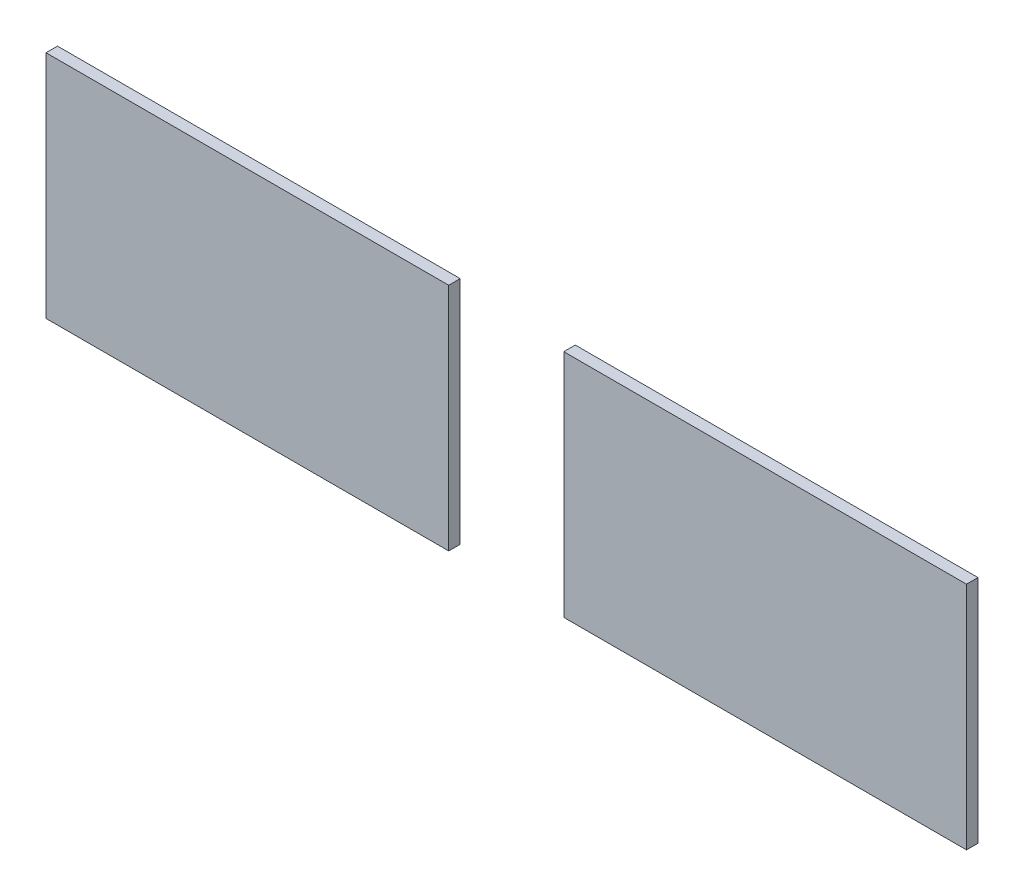
from build123d import *

# Parameters (mm, degrees)
SKETCH_1_W        = 0.7
SKETCH_1_H        = 0.4
EXTRUDE_1_DEPTH   = 0.02
EXTRUDE_1_2_DEPTH = 0.02


with BuildPart() as part:
    # 草图1 → 凸台-拉伸1 (new body)
    with BuildSketch(Plane.XY):
        with Locations((-0.45, 0)):
            Rectangle(SKETCH_1_W, SKETCH_1_H)
    extrude(amount=EXTRUDE_1_DEPTH)


with BuildPart() as body_2:
    # 草图1 → Extrude 1 2 (new body)
    with BuildSketch(Plane.XY):
        with Locations((0.45, 0)):
            Rectangle(SKETCH_1_W, SKETCH_1_H)
    extrude(amount=EXTRUDE_1_2_DEPTH)


solid = Compound([part.part, body_2.part])
